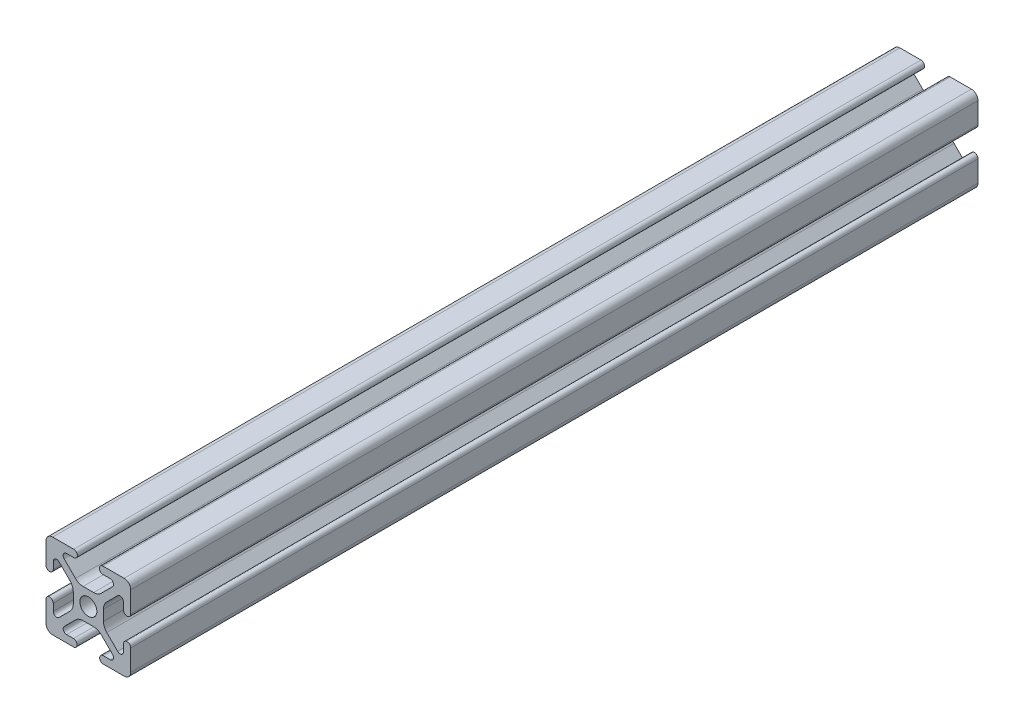
from build123d import *

# Parameters (mm, degrees)
SKETCH1_R           = 2.5
BOSS_EXTRUDE1_DEPTH = 250


with BuildPart() as part:
    # Sketch1 → Boss-Extrude1 (new body)
    with BuildSketch(Plane(origin=(0, 0, -25), x_dir=(-1, 0, 0), z_dir=(0, 0, -1))):
        with BuildLine():
            Line((12.5, 4.32), (12.5, 10.537068835))
            ThreePointArc((12.5, 10.537068835), (11.925070773, 11.925070773), (10.537068835, 12.5))
            Line((10.537068835, 12.5), (4.32, 12.5))
            ThreePointArc((4.32, 12.5), (3.25, 11.43), (4.32, 10.36))
            Line((4.32, 10.36), (6.42, 10.36))
            ThreePointArc((6.42, 10.36), (7.35325999, 9.736168088), (7.133653911, 8.635298598))
            Line((7.133653911, 8.635298598), (3.795290766, 5.301828272))
            ThreePointArc((3.795290766, 5.301828272), (2.76743922, 4.61585726), (1.555406707, 4.375))
            Line((1.555406707, 4.375), (-1.555406707, 4.375))
            ThreePointArc((-1.555406707, 4.375), (-2.76743922, 4.61585726), (-3.795290766, 5.301828272))
            Line((-3.795290766, 5.301828272), (-7.133653912, 8.635298598))
            ThreePointArc((-7.133653912, 8.635298598), (-7.35325999, 9.736168088), (-6.42, 10.36))
            Line((-6.42, 10.36), (-4.32, 10.36))
            ThreePointArc((-4.32, 10.36), (-3.25, 11.43), (-4.32, 12.5))
            Line((-4.32, 12.5), (-10.537068835, 12.5))
            ThreePointArc((-10.537068835, 12.5), (-11.925070773, 11.925070773), (-12.5, 10.537068835))
            Line((-12.5, 10.537068835), (-12.5, 4.32))
            ThreePointArc((-12.5, 4.32), (-11.43, 3.25), (-10.36, 4.32))
            Line((-10.36, 4.32), (-10.36, 6.396886949))
            ThreePointArc((-10.36, 6.396886949), (-9.736852394, 7.329863489), (-8.636346088, 7.111588351))
            Line((-8.636346088, 7.111588351), (-5.432204773, 3.912143135))
            ThreePointArc((-5.432204773, 3.912143135), (-4.708985779, 2.831057106), (-4.455, 1.555406707))
            Line((-4.455, 1.555406707), (-4.455, -1.555406707))
            ThreePointArc((-4.455, -1.555406707), (-4.708985779, -2.831057106), (-5.432204773, -3.912143135))
            Line((-5.432204773, -3.912143135), (-8.636346088, -7.111588351))
            ThreePointArc((-8.636346088, -7.111588351), (-9.736852394, -7.329863489), (-10.36, -6.396886949))
            Line((-10.36, -6.396886949), (-10.36, -4.32))
            ThreePointArc((-10.36, -4.32), (-11.43, -3.25), (-12.5, -4.32))
            Line((-12.5, -4.32), (-12.5, -10.537068835))
            ThreePointArc((-12.5, -10.537068835), (-11.925070773, -11.925070773), (-10.537068835, -12.5))
            Line((-10.537068835, -12.5), (-4.387856959, -12.5))
            ThreePointArc((-4.387856959, -12.5), (-3.317856959, -11.43), (-4.387856959, -10.36))
            Line((-4.387856959, -10.36), (-6.42, -10.36))
            ThreePointArc((-6.42, -10.36), (-7.35325999, -9.736168088), (-7.133653912, -8.635298598))
            Line((-7.133653912, -8.635298598), (-3.795290766, -5.301828272))
            ThreePointArc((-3.795290766, -5.301828272), (-2.76743922, -4.61585726), (-1.555406707, -4.375))
            Line((-1.555406707, -4.375), (1.555406707, -4.375))
            ThreePointArc((1.555406707, -4.375), (2.76743922, -4.61585726), (3.795290766, -5.301828272))
            Line((3.795290766, -5.301828272), (7.133653912, -8.635298598))
            ThreePointArc((7.133653912, -8.635298598), (7.35325999, -9.736168088), (6.42, -10.36))
            Line((6.42, -10.36), (4.387856959, -10.36))
            ThreePointArc((4.387856959, -10.36), (3.317856959, -11.43), (4.387856959, -12.5))
            Line((4.387856959, -12.5), (10.537068835, -12.5))
            ThreePointArc((10.537068835, -12.5), (11.925070773, -11.925070773), (12.5, -10.537068835))
            Line((12.5, -10.537068835), (12.5, -4.32))
            ThreePointArc((12.5, -4.32), (11.43, -3.25), (10.36, -4.32))
            Line((10.36, -4.32), (10.36, -6.396886949))
            ThreePointArc((10.36, -6.396886949), (9.736852394, -7.329863489), (8.636346088, -7.111588351))
            Line((8.636346088, -7.111588351), (5.432204773, -3.912143135))
            ThreePointArc((5.432204773, -3.912143135), (4.708985779, -2.831057106), (4.455, -1.555406707))
            Line((4.455, -1.555406707), (4.455, 1.555406707))
            ThreePointArc((4.455, 1.555406707), (4.708985779, 2.831057106), (5.432204773, 3.912143135))
            Line((5.432204773, 3.912143135), (8.636346088, 7.111588351))
            ThreePointArc((8.636346088, 7.111588351), (9.736852394, 7.329863489), (10.36, 6.396886949))
            Line((10.36, 6.396886949), (10.36, 4.32))
            ThreePointArc((10.36, 4.32), (11.43, 3.25), (12.5, 4.32))
        make_face()
        with Locations(Location((0, 0, 0), (0, 0, 180))):
            Circle(SKETCH1_R, mode=Mode.SUBTRACT)
    extrude(amount=-BOSS_EXTRUDE1_DEPTH)


solid = part.part
